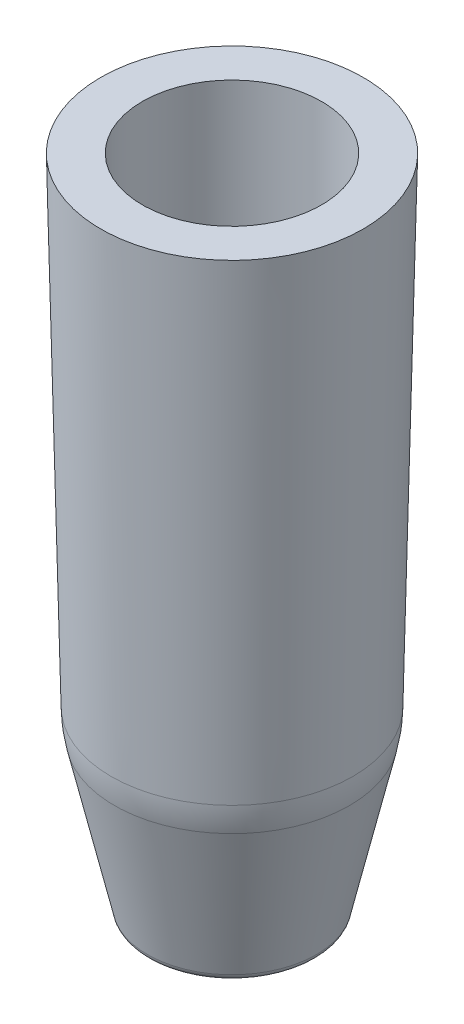
from build123d import *

# Parameters (mm, degrees)
FILLET_1_R = 0.2
FILLET_2_R = 3


with BuildPart() as part:
    # Эскиз1 → Повернуть1 (revolve)
    with BuildSketch(Plane.XY):
        Polygon((-2, 0), (-2.93, 0), (-2.69, -11), (-1.85, -14.7), (-1, -14.7), (-1.7, -8.1), (-2, -7.8), align=None)
    revolve(axis=Axis((0, 0, 0), (0, -1, 0)))

    # Скругление1
    fillet_1_edges = [part.edges().sort_by_distance(p)[0] for p in [
        (1.85, -14.7, 0),
    ]]
    fillet(fillet_1_edges, radius=FILLET_1_R)

    # Скругление2
    fillet_2_edges = [part.edges().sort_by_distance(p)[0] for p in [
        (2.69, -11, 0),
    ]]
    fillet(fillet_2_edges, radius=FILLET_2_R)


solid = part.part
